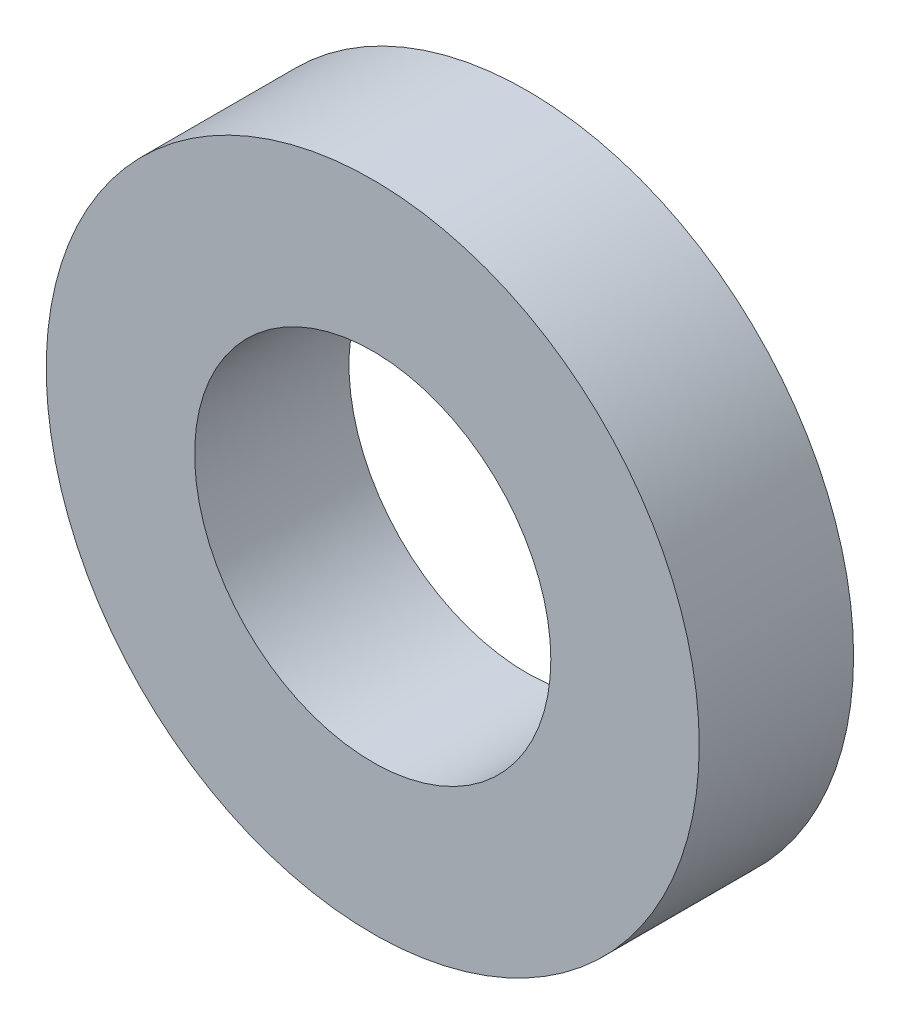
from build123d import *

# Parameters (mm, degrees)
SKETCH1_W = 13
SKETCH1_H = 12.5


with BuildPart() as part:
    # Sketch1 → Revolve1 (revolve)
    with BuildSketch(Plane(origin=(0, 0, 0), x_dir=(0, 0, -1), z_dir=(1, 0, 0)), mode=Mode.PRIVATE) as revolve1_sk:
        with Locations((6.5, 21.25)):
            Rectangle(SKETCH1_W, SKETCH1_H)
    revolve(revolve1_sk.sketch.rotate(Axis((0, 0, 0), (0, 0, -1)), 90), axis=Axis((0, 0, 0), (0, 0, -1)))


solid = part.part
